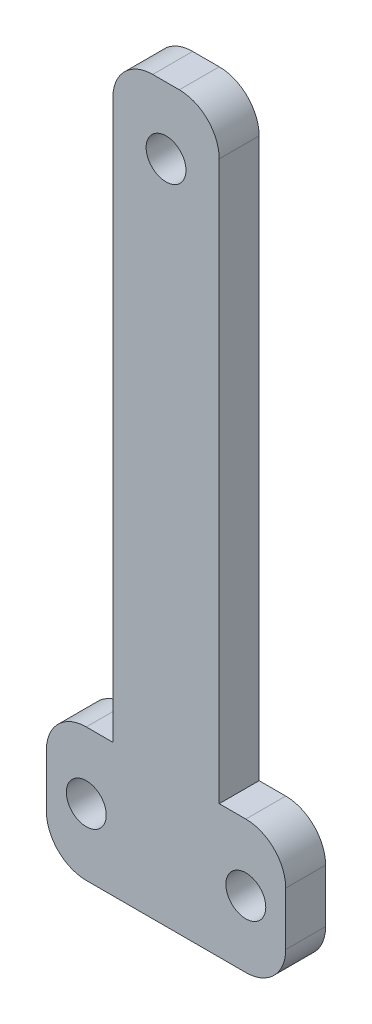
from build123d import *

# Parameters (mm, degrees)
CROQUIS1_R              = 1.5
SALIENTE_EXTRUIR1_DEPTH = 1.5


with BuildPart() as part:
    # Croquis1 → Saliente-Extruir1 (new, symmetric)
    # profile 1 of 4: a face of its own
    with BuildSketch(Plane.XY):
        with BuildLine():
            Line((-4, 24.5), (-4, -17.5))
            Line((-4, -17.5), (4, -17.5))
            Line((4, -17.5), (4, 24.5))
            ThreePointArc((4, 24.5), (3.121320344, 26.621320344), (1, 27.5))
            Line((1, 27.5), (-1, 27.5))
            ThreePointArc((-1, 27.5), (-3.121320344, 26.621320344), (-4, 24.5))
        make_face()
        with Locations((0, 22.5)):
            Circle(CROQUIS1_R, mode=Mode.SUBTRACT)
    # profile 2 of 4: a face of its own
    with BuildSketch(Plane.XY):
        with BuildLine():
            Line((-6, -27.5), (-1, -27.5))
            ThreePointArc((-1, -27.5), (-3.121320344, -26.621320344), (-4, -24.5))
            Line((-4, -24.5), (-4, -17.5))
            Line((-4, -17.5), (-6, -17.5))
            ThreePointArc((-6, -17.5), (-8.121320344, -18.378679656), (-9, -20.5))
            Line((-9, -20.5), (-9, -24.5))
            ThreePointArc((-9, -24.5), (-8.121320344, -26.621320344), (-6, -27.5))
        make_face()
        with Locations((-6, -22.5)):
            Circle(CROQUIS1_R, mode=Mode.SUBTRACT)
    # profile 3 of 4: a face of its own
    with BuildSketch(Plane.XY):
        with BuildLine():
            ThreePointArc((-4, -24.5), (-3.121320344, -26.621320344), (-1, -27.5))
            Line((-1, -27.5), (1, -27.5))
            ThreePointArc((1, -27.5), (3.121320344, -26.621320344), (4, -24.5))
            Line((4, -24.5), (4, -17.5))
            Line((4, -17.5), (-4, -17.5))
            Line((-4, -17.5), (-4, -24.5))
        make_face()
    # profile 4 of 4: a face of its own
    with BuildSketch(Plane.XY):
        with BuildLine():
            ThreePointArc((4, -24.5), (3.121320344, -26.621320344), (1, -27.5))
            Line((1, -27.5), (6, -27.5))
            ThreePointArc((6, -27.5), (8.121320344, -26.621320344), (9, -24.5))
            Line((9, -24.5), (9, -20.5))
            ThreePointArc((9, -20.5), (8.121320344, -18.378679656), (6, -17.5))
            Line((6, -17.5), (4, -17.5))
            Line((4, -17.5), (4, -24.5))
        make_face()
        with Locations((6, -22.5)):
            Circle(CROQUIS1_R, mode=Mode.SUBTRACT)
    extrude(amount=SALIENTE_EXTRUIR1_DEPTH, both=True)


solid = part.part
